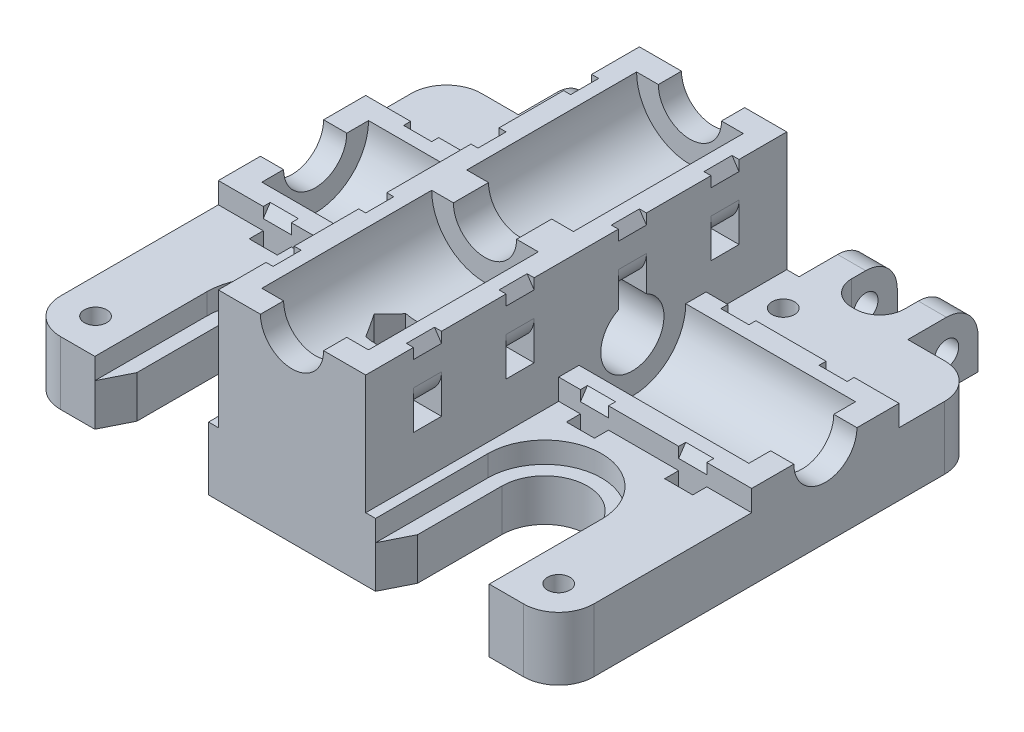
from build123d import *

# Parameters (mm, degrees)
BOSS_EXTRUDE1_DEPTH             = 12
SKETCH5_W                       = 21
SKETCH5_H                       = 60
BOSS_EXTRUDE4_DEPTH             = 14
BOSS_EXTRUDE4_DIRECTION_2_REACH = 47.044
SKETCH8_W                       = 27.5
SKETCH8_H                       = 27.5
SKETCH8_H_2                     = 11.5
BOSS_EXTRUDE5_DEPTH             = 9
CUT_EXTRUDE2_DEPTH              = 3
CUT_EXTRUDE3_DEPTH              = 54.853969213
FILLET1_R                       = 5
SKETCH11_R                      = 1.6
CUT_EXTRUDE4_DEPTH              = 53.813350585
SKETCH12_R                      = 1.6
CUT_EXTRUDE5_DEPTH              = 57.358229213
CUT_EXTRUDE6_DEPTH              = 17
SKETCH15_W                      = 4
SKETCH15_H                      = 10
BOSS_EXTRUDE7_DEPTH             = 9
FILLET2_R                       = 4.5
FILLET3_R                       = 3.5
FILLET2_OF_MIRROR2_R            = 4.5
FILLET3_OF_MIRROR2_R            = 3.5
CUT_EXTRUDE7_REACH              = 84.494
SKETCH17_R                      = 1.75
SKETCH18_W                      = 4
SKETCH18_H                      = 2
CUT_EXTRUDE8_DEPTH              = 60.491596045
SKETCH19_W                      = 4
SKETCH19_H                      = 2
CUT_EXTRUDE9_DEPTH              = 21
FILLET4_R                       = 5
FILLET4_OF_MIRROR4_R            = 5
SKETCH20_W                      = 4
SKETCH20_H                      = 2
CUT_EXTRUDE13_DEPTH             = 21
FILLET5_R                       = 3.5
CUT_EXTRUDE14_DEPTH             = 4
CUT_EXTRUDE15_DEPTH             = 4
MIRROR7_COPY_1_DEPTH            = 4
MIRROR7_COPY_2_DEPTH            = 4
CUT_EXTRUDE16_DEPTH             = 4
CUT_EXTRUDE17_DEPTH             = 4
MIRROR9_COPY_1_DEPTH            = 4
MIRROR9_COPY_2_DEPTH            = 4


with BuildPart() as part:
    # Sketch1 → Boss-Extrude1 (new body)
    with BuildSketch(Plane(origin=(0, 0, 0), x_dir=(1, 0, 0), z_dir=(0, 1, 0))):
        Polygon((0, 0), (-38, 0), (-38, 21), (38, 21), (38, 0), align=None)
    extrude(amount=BOSS_EXTRUDE1_DEPTH)

    # Sketch5 → Boss-Extrude4 (add)
    with BuildSketch(Plane(origin=(0, 12, 0), x_dir=(1, 0, 0), z_dir=(0, 1, 0))):
        with Locations((0, 2.5)):
            Rectangle(SKETCH5_W, SKETCH5_H)
    extrude(amount=BOSS_EXTRUDE4_DEPTH)

    # Boss-Extrude4 direction 2: up to this face of the body (flat: up to its plane)
    boss_extrude4_direction_2_end = Plane(part.part.faces().sort_by_distance((0, 0, -10.5))[0])
    # Sketch5 → Boss-Extrude4 direction 2 (add, up to the picked face)
    with BuildSketch(Plane(origin=(0, 12, 0), x_dir=(1, 0, 0), z_dir=(0, 1, 0)), mode=Mode.PRIVATE) as boss_extrude4_direction_2_sk1:
        with Locations((0, 2.5)):
            Rectangle(SKETCH5_W, SKETCH5_H)
    boss_extrude4_direction_2_tool1 = split(extrude(boss_extrude4_direction_2_sk1.sketch, amount=-BOSS_EXTRUDE4_DIRECTION_2_REACH, mode=Mode.PRIVATE), bisect_by=boss_extrude4_direction_2_end, keep=Keep.BOTH, mode=Mode.PRIVATE)
    add(boss_extrude4_direction_2_tool1.solids().sort_by(Axis((0, 12, -2.5), (0, -1, 0)))[0])

    # Sketch6 → Cut-Revolve1 (revolve, cut)
    with BuildSketch(Plane(origin=(0, 12, 0), x_dir=(1, 0, 0), z_dir=(0, 1, 0)), mode=Mode.PRIVATE) as cut_revolve1_sk:
        Polygon((-38, 10.5), (38, 10.5), (38, 15), (34.7, 15), (34.7, 18.1), (10.5, 18.1), (10.5, 15), (-10.5, 15), (-10.5, 18.1), (-34.7, 18.1), (-34.7, 15), (-38, 15), align=None)
    revolve(cut_revolve1_sk.sketch.rotate(Axis((-48.606345373, 12, -10.5), (1, 0, 0)), 180), axis=Axis((-48.606345373, 12, -10.5), (1, 0, 0)), mode=Mode.SUBTRACT)

    # Sketch7 → Cut-Revolve2 (revolve, cut)
    with BuildSketch(Plane(origin=(0, 26, 0), x_dir=(1, 0, 0), z_dir=(0, 1, 0))):
        Polygon((0, 32.5), (0, -27.5), (4.5, -27.5), (4.5, -24.2), (7.6, -24.2), (7.6, 0), (4.5, 0), (4.5, 5), (7.6, 5), (7.6, 29.2), (4.5, 29.2), (4.5, 32.5), align=None)
    revolve(axis=Axis((0, 26, -39.395208757), (0, 0, 1)), mode=Mode.SUBTRACT)

    # Sketch8 → Boss-Extrude5 (add)
    with BuildSketch(Plane.XZ):
        with Locations((-24.25, 13.75)):
            Rectangle(SKETCH8_W, SKETCH8_H)
        with Locations((24.25, 13.75)):
            Rectangle(SKETCH8_W, SKETCH8_H)
        with Locations((24.25, -26.75)):
            Rectangle(SKETCH8_W, SKETCH8_H_2)
        with Locations((-24.25, -26.75)):
            Rectangle(SKETCH8_W, SKETCH8_H_2)
    extrude(amount=-BOSS_EXTRUDE5_DEPTH)

    # Sketch9 → Cut-Extrude2 (cut)
    with BuildSketch(Plane(origin=(0, 9, 0), x_dir=(1, 0, 0), z_dir=(0, 1, 0))):
        with BuildLine():
            Line((11.9, -11.5), (11.9, -27.5))
            Line((11.9, -27.5), (28.1, -27.5))
            Line((28.1, -27.5), (28.1, -11.5))
            ThreePointArc((28.1, -11.5), (20, -3.4), (11.9, -11.5))
        make_face()
    cut_extrude2 = extrude(amount=-CUT_EXTRUDE2_DEPTH, mode=Mode.SUBTRACT)

    # Sketch10 → Cut-Extrude3 (cut, through all)
    with BuildSketch(Plane(origin=(0, 6, 0), x_dir=(1, 0, 0), z_dir=(0, 1, 0))):
        with BuildLine():
            Line((13.9, -11.5), (13.9, -23.5))
            Line((13.9, -23.5), (11.9, -27.5))
            Line((11.9, -27.5), (28.1, -27.5))
            Line((28.1, -27.5), (26.1, -23.5))
            Line((26.1, -23.5), (26.1, -11.5))
            ThreePointArc((26.1, -11.5), (20, -5.4), (13.9, -11.5))
        make_face()
    cut_extrude3 = extrude(amount=-CUT_EXTRUDE3_DEPTH, mode=Mode.SUBTRACT)

    # Mirror1: Cut-Extrude2, Cut-Extrude3 across plane
    add(cut_extrude2.mirror(Plane(origin=(0, 0, 0), x_dir=(0, 0, 1), z_dir=(1, 0, 0))), mode=Mode.SUBTRACT)
    add(cut_extrude3.mirror(Plane(origin=(0, 0, 0), x_dir=(0, 0, 1), z_dir=(1, 0, 0))), mode=Mode.SUBTRACT)

    # Fillet1
    fillet1_edges = [part.edges().sort_by_distance(p)[0] for p in [
        (-38, 4.5, 27.5),
        (38, 4.5, 27.5),
        (38, 4.5, -32.5),
        (-38, 4.5, -32.5),
    ]]
    fillet(fillet1_edges, radius=FILLET1_R)

    # Sketch11 → Cut-Extrude4 (cut, through all)
    with BuildSketch(Plane(origin=(0, 9, 0), x_dir=(1, 0, 0), z_dir=(0, 1, 0))):
        with Locations(Location((33, -22.5, 0), (0, 0, 270))):
            Circle(SKETCH11_R)
        with Locations(Location((15, 27.5, 0), (0, 0, 270))):
            Circle(SKETCH11_R)
        with Locations(Location((-15, 27.5, 0), (0, 0, 270))):
            Circle(SKETCH11_R)
        with Locations(Location((-33, -22.5, 0), (0, 0, 270))):
            Circle(SKETCH11_R)
    extrude(amount=-CUT_EXTRUDE4_DEPTH, mode=Mode.SUBTRACT)

    # Sketch12 → Cut-Extrude5 (cut, through all)
    with BuildSketch(Plane.XZ):
        with Locations(Location((0, 12.5, 0), (0, 0, 270))):
            Circle(SKETCH12_R)
    extrude(amount=-CUT_EXTRUDE5_DEPTH, mode=Mode.SUBTRACT)

    # Sketch13 → Cut-Extrude6 (cut)
    with BuildSketch(Plane(origin=(0, 26, 0), x_dir=(1, 0, 0), z_dir=(0, 1, 0))):
        Polygon((3.290896534, -12.5), (1.645448267, -9.65), (-1.645448267, -9.65), (-3.290896534, -12.5), (-1.645448267, -15.35), (1.645448267, -15.35), align=None)
    extrude(amount=-CUT_EXTRUDE6_DEPTH, mode=Mode.SUBTRACT)

    # Sketch15 → Boss-Extrude7 (add)
    with BuildSketch(Plane(origin=(0, 9, 0), x_dir=(1, 0, 0), z_dir=(0, 1, 0))):
        with Locations((25.75, 37.5)):
            Rectangle(SKETCH15_W, SKETCH15_H)
        with Locations((14.25, 37.5)):
            Rectangle(SKETCH15_W, SKETCH15_H)
    boss_extrude7 = extrude(amount=-BOSS_EXTRUDE7_DEPTH)

    # Fillet2
    fillet2_edges = [part.edges().sort_by_distance(p)[0] for p in [
        (14.25, 9, -42.5),
        (25.75, 9, -42.5),
    ]]
    fillet(fillet2_edges, radius=FILLET2_R)

    # Fillet3
    fillet3_edges = [part.edges().sort_by_distance(p)[0] for p in [
        (16.25, 4.5, -32.5),
        (23.75, 4.5, -32.5),
    ]]
    fillet(fillet3_edges, radius=FILLET3_R)

    # Mirror2: Boss-Extrude7 across plane
    add(boss_extrude7.mirror(Plane(origin=(0, 0, 0), x_dir=(0, 0, 1), z_dir=(1, 0, 0))))

    # Fillet2 of Mirror2
    fillet2_of_mirror2_edges = [part.edges().sort_by_distance(p)[0] for p in [
        (-14.25, 9, -42.5),
        (-25.75, 9, -42.5),
    ]]
    fillet(fillet2_of_mirror2_edges, radius=FILLET2_OF_MIRROR2_R)

    # Fillet3 of Mirror2
    fillet3_of_mirror2_edges = [part.edges().sort_by_distance(p)[0] for p in [
        (-16.25, 4.5, -32.5),
        (-23.75, 4.5, -32.5),
    ]]
    fillet(fillet3_of_mirror2_edges, radius=FILLET3_OF_MIRROR2_R)

    # Cut-Extrude7: up to this face of the body (flat: up to its plane)
    cut_extrude7_end = Plane(part.part.faces().sort_by_distance((-27.75, 4.322688438, -37.297320847))[0])
    # Sketch17 → Cut-Extrude7 (cut, up to the picked face)
    with BuildSketch(Plane(origin=(27.75, 0, 0), x_dir=(0, 0, -1), z_dir=(1, 0, 0)), mode=Mode.PRIVATE) as cut_extrude7_sk1:
        with Locations((38, 4.5)):
            Circle(SKETCH17_R)
    cut_extrude7_tool1 = split(extrude(cut_extrude7_sk1.sketch, amount=-CUT_EXTRUDE7_REACH, mode=Mode.PRIVATE), bisect_by=cut_extrude7_end, keep=Keep.BOTH, mode=Mode.PRIVATE)
    add(cut_extrude7_tool1.solids().sort_by(Axis((27.75, 4.5, -38), (-1, 0, 0)))[0], mode=Mode.SUBTRACT)

    # Sketch18 → Cut-Extrude8 (cut, through all)
    with BuildSketch(Plane(origin=(0, 9, 0), x_dir=(1, 0, 0), z_dir=(0, 1, 0))):
        with Locations((15.6, -1)):
            Rectangle(SKETCH18_W, SKETCH18_H)
        with Locations((29.6, -1)):
            Rectangle(SKETCH18_W, SKETCH18_H)
        with Locations((29.6, 22)):
            Rectangle(SKETCH18_W, SKETCH18_H)
        with Locations((15.6, 22)):
            Rectangle(SKETCH18_W, SKETCH18_H)
    cut_extrude8 = extrude(amount=-CUT_EXTRUDE8_DEPTH, mode=Mode.SUBTRACT)

    # Sketch19 → Cut-Extrude9 (cut)
    with BuildSketch(Plane(origin=(0, 0, -21), x_dir=(-1, 0, 0), z_dir=(0, 0, -1))):
        with Locations((-29.6, 1)):
            Rectangle(SKETCH19_W, SKETCH19_H)
        with Locations((-15.6, 1)):
            Rectangle(SKETCH19_W, SKETCH19_H)
    cut_extrude9 = extrude(amount=-CUT_EXTRUDE9_DEPTH, mode=Mode.SUBTRACT)

    # Fillet4
    fillet4_edges = [part.edges().sort_by_distance(p)[0] for p in [
        (29.6, 2, -21),
        (29.6, 2, 0),
        (15.6, 2, -21),
        (15.6, 2, 0),
    ]]
    fillet(fillet4_edges, radius=FILLET4_R)

    # Mirror4: Cut-Extrude8, Cut-Extrude9 across plane
    add(cut_extrude8.mirror(Plane(origin=(0, 0, 0), x_dir=(0, 0, 1), z_dir=(1, 0, 0))), mode=Mode.SUBTRACT)
    add(cut_extrude9.mirror(Plane(origin=(0, 0, 0), x_dir=(0, 0, 1), z_dir=(1, 0, 0))), mode=Mode.SUBTRACT)

    # Fillet4 of Mirror4
    fillet4_of_mirror4_edges = [part.edges().sort_by_distance(p)[0] for p in [
        (-29.6, 2, -21),
        (-29.6, 2, 0),
        (-15.6, 2, -21),
        (-15.6, 2, 0),
    ]]
    fillet(fillet4_of_mirror4_edges, radius=FILLET4_OF_MIRROR4_R)

    # Sketch20 → Cut-Extrude13 (cut)
    with BuildSketch(Plane(origin=(10.5, 0, 0), x_dir=(0, 0, -1), z_dir=(1, 0, 0))):
        with Locations((-18.699999327, 16.5)):
            Rectangle(SKETCH20_W, SKETCH20_H)
        with Locations((-5.500000673, 16.5)):
            Rectangle(SKETCH20_W, SKETCH20_H)
        with Locations((10.500000673, 16.5)):
            Rectangle(SKETCH20_W, SKETCH20_H)
        with Locations((23.699999327, 16.5)):
            Rectangle(SKETCH20_W, SKETCH20_H)
    extrude(amount=-CUT_EXTRUDE13_DEPTH, mode=Mode.SUBTRACT)

    # Fillet5
    fillet5_edges = [part.edges().sort_by_distance(p)[0] for p in [
        (10.5, 17.5, 18.699999327),
        (-10.5, 17.5, 18.699999327),
        (10.5, 17.5, 5.500000673),
        (-10.5, 17.5, 5.500000673),
        (10.5, 17.5, -10.500000673),
        (-10.5, 17.5, -10.500000673),
        (10.5, 17.5, -23.699999327),
        (-10.5, 17.5, -23.699999327),
    ]]
    fillet(fillet5_edges, radius=FILLET5_R)

    # Sketch21 → Cut-Extrude14 (cut)
    with BuildSketch(Plane.XY.offset(16.699999327)):
        Polygon((9.5, 26), (10.5, 24.5), (10.5, 26), align=None)
    cut_extrude14 = extrude(amount=CUT_EXTRUDE14_DEPTH, mode=Mode.SUBTRACT)

    # Sketch22 → Cut-Extrude15 (cut)
    with BuildSketch(Plane.XY.offset(3.500000673)):
        Polygon((10.5, 26), (9.5, 26), (10.5, 24.5), align=None)
    cut_extrude15 = extrude(amount=CUT_EXTRUDE15_DEPTH, mode=Mode.SUBTRACT)

    # Mirror5: Cut-Extrude14, Cut-Extrude15 across plane
    add(cut_extrude14.mirror(Plane(origin=(0, 0, 0), x_dir=(0, 0, 1), z_dir=(1, 0, 0))), mode=Mode.SUBTRACT)
    add(cut_extrude15.mirror(Plane(origin=(0, 0, 0), x_dir=(0, 0, 1), z_dir=(1, 0, 0))), mode=Mode.SUBTRACT)

    # Mirror7: Cut-Extrude14, Cut-Extrude15 across plane
    add(cut_extrude14.mirror(Plane(origin=(0, 0, -2.5), x_dir=(1, 0, 0), z_dir=(0, 0, -1))), mode=Mode.SUBTRACT)
    add(cut_extrude15.mirror(Plane(origin=(0, 0, -2.5), x_dir=(1, 0, 0), z_dir=(0, 0, -1))), mode=Mode.SUBTRACT)

    # Mirror7 copy 1 sketch → Mirror7 copy 1 (cut)
    with BuildSketch(Plane(origin=(0, 0, -21.699999327), x_dir=(-1, 0, 0), z_dir=(0, 0, -1))):
        Polygon((9.5, 26), (10.5, 24.5), (10.5, 26), align=None)
    extrude(amount=MIRROR7_COPY_1_DEPTH, mode=Mode.SUBTRACT)

    # Mirror7 copy 2 sketch → Mirror7 copy 2 (cut)
    with BuildSketch(Plane(origin=(0, 0, -8.500000673), x_dir=(-1, 0, 0), z_dir=(0, 0, -1))):
        Polygon((10.5, 26), (9.5, 26), (10.5, 24.5), align=None)
    extrude(amount=MIRROR7_COPY_2_DEPTH, mode=Mode.SUBTRACT)

    # Sketch23 → Cut-Extrude16 (cut)
    with BuildSketch(Plane(origin=(13.6, 0, 0), x_dir=(0, 0, -1), z_dir=(1, 0, 0))):
        Polygon((0, 12), (0, 10.5), (1, 12), align=None)
    cut_extrude16 = extrude(amount=CUT_EXTRUDE16_DEPTH, mode=Mode.SUBTRACT)

    # Sketch24 → Cut-Extrude17 (cut)
    with BuildSketch(Plane(origin=(27.6, 0, 0), x_dir=(0, 0, -1), z_dir=(1, 0, 0))):
        Polygon((0, 12), (0, 10.5), (1, 12), align=None)
    cut_extrude17 = extrude(amount=CUT_EXTRUDE17_DEPTH, mode=Mode.SUBTRACT)

    # Mirror8: Cut-Extrude16, Cut-Extrude17 across plane
    add(cut_extrude16.mirror(Plane.XY.offset(-10.5)), mode=Mode.SUBTRACT)
    add(cut_extrude17.mirror(Plane.XY.offset(-10.5)), mode=Mode.SUBTRACT)

    # Mirror9: Cut-Extrude16, Cut-Extrude17 across plane
    add(cut_extrude16.mirror(Plane(origin=(0, 0, 0), x_dir=(0, 0, 1), z_dir=(1, 0, 0))), mode=Mode.SUBTRACT)
    add(cut_extrude17.mirror(Plane(origin=(0, 0, 0), x_dir=(0, 0, 1), z_dir=(1, 0, 0))), mode=Mode.SUBTRACT)

    # Mirror9 copy 1 sketch → Mirror9 copy 1 (cut)
    with BuildSketch(Plane(origin=(-13.6, 0, -21), x_dir=(0, 0, 1), z_dir=(-1, 0, 0))):
        Polygon((0, 12), (0, 10.5), (1, 12), align=None)
    extrude(amount=MIRROR9_COPY_1_DEPTH, mode=Mode.SUBTRACT)

    # Mirror9 copy 2 sketch → Mirror9 copy 2 (cut)
    with BuildSketch(Plane(origin=(-27.6, 0, -21), x_dir=(0, 0, 1), z_dir=(-1, 0, 0))):
        Polygon((0, 12), (0, 10.5), (1, 12), align=None)
    extrude(amount=MIRROR9_COPY_2_DEPTH, mode=Mode.SUBTRACT)


solid = part.part
